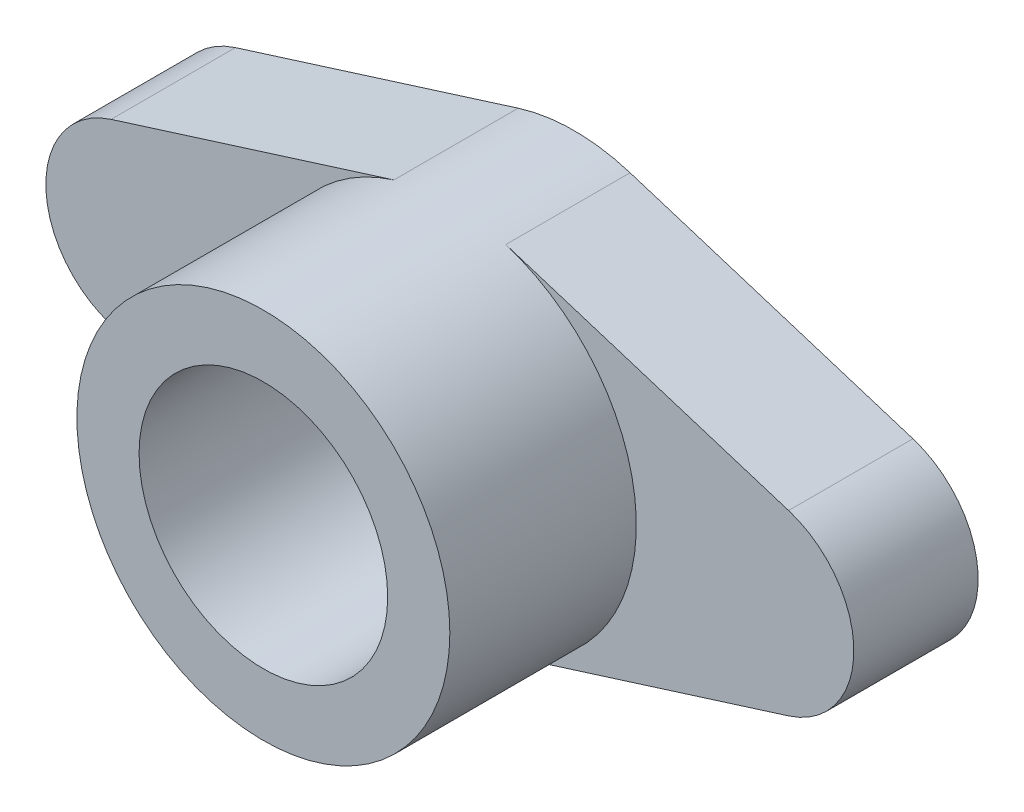
from build123d import *

# Parameters (mm, degrees)
SKETCH1_R           = 20
BOSS_EXTRUDE1_DEPTH = 20
SKETCH2_R           = 30
SKETCH2_R_2         = 20
BOSS_EXTRUDE2_DEPTH = 30


with BuildPart() as part:
    # Sketch1 → Boss-Extrude1 (new body)
    with BuildSketch(Plane.XY):
        with BuildLine():
            Line((-9, 28.618176043), (-54.5, 14.309088021))
            ThreePointArc((-54.5, 14.309088021), (-65, 0), (-54.5, -14.309088021))
            Line((-54.5, -14.309088021), (-9, -28.618176043))
            ThreePointArc((-9, -28.618176043), (0, -30), (9, -28.618176043))
            Line((9, -28.618176043), (54.5, -14.309088021))
            ThreePointArc((54.5, -14.309088021), (65, 0), (54.5, 14.309088021))
            Line((54.5, 14.309088021), (9, 28.618176043))
            ThreePointArc((9, 28.618176043), (0, 30), (-9, 28.618176043))
        make_face()
        Circle(SKETCH1_R, mode=Mode.SUBTRACT)
    extrude(amount=BOSS_EXTRUDE1_DEPTH)

    # Sketch2 → Boss-Extrude2 (add)
    with BuildSketch(Plane.XY.offset(20)):
        with Locations(Location((0, 0, 0), (0, 0, 107.457603124))):
            Circle(SKETCH2_R)
        Circle(SKETCH2_R_2, mode=Mode.SUBTRACT)
    extrude(amount=BOSS_EXTRUDE2_DEPTH)


solid = part.part
